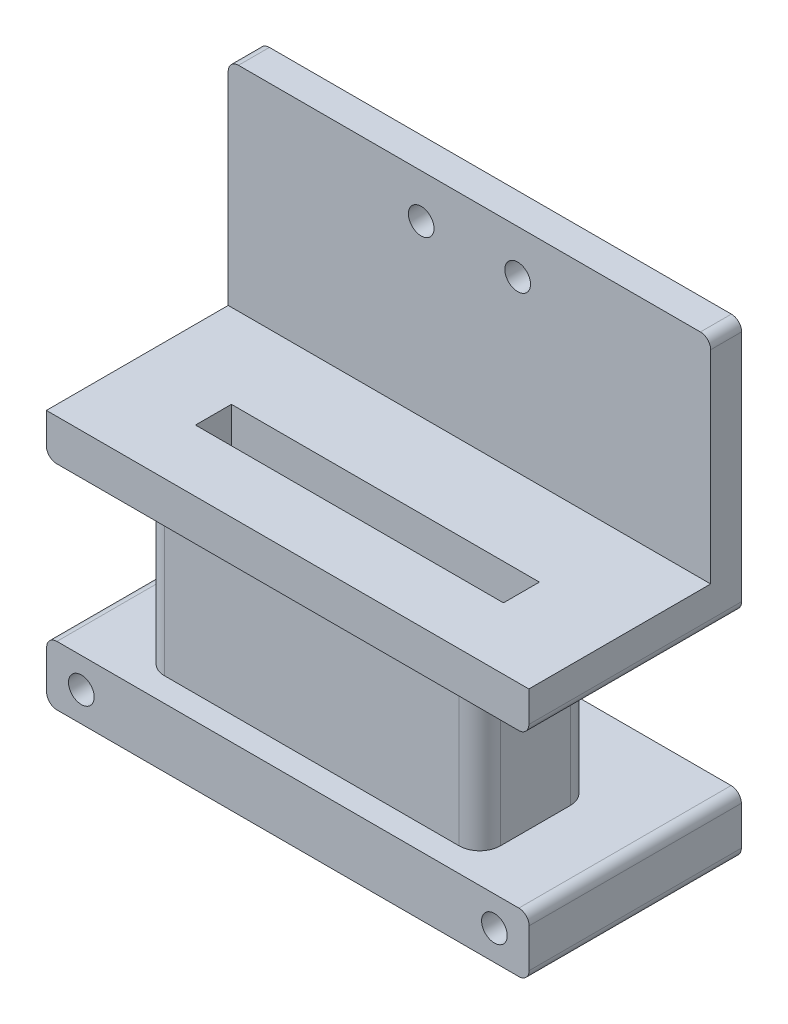
from build123d import *

# Parameters (mm, degrees)
SKETCH1_W             = 32.708231768
SKETCH1_H             = 10.82386404
SKETCH1_W_2           = 30
SKETCH1_H_2           = 3.5
BOSS_EXTRUDE2_DEPTH   = 15
SKETCH4_W             = 47
SKETCH4_H             = 15.552838856
SKETCH4_W_2           = 30
SKETCH4_H_2           = 3.5
BOSS_EXTRUDE4_DEPTH   = 4
SKETCH7_W             = 47
SKETCH7_H             = 15.5
SKETCH7_W_2           = 30
SKETCH7_H_2           = 3.5
BOSS_EXTRUDE5_DEPTH   = 5.782
SKETCH25_W            = 47
SKETCH25_H            = 5.782
BOSS_EXTRUDE9_DEPTH   = 5.175
M3X0_5_TAPPED_HOLE1_D = 2.5
FILLET5_R             = 2
SKETCH26_W            = 47
SKETCH26_H            = 4
BOSS_EXTRUDE10_DEPTH  = 5.175
SKETCH17_W            = 47
SKETCH17_H            = 3.015322823
BOSS_EXTRUDE7_DEPTH   = 20.76
M3X0_5_TAPPED_HOLE2_D = 2.5
FILLET6_R             = 1
FILLET8_R             = 1
FILLET9_R             = 1
FILLET10_R            = 1


with BuildPart() as part:
    # Sketch1 → Boss-Extrude2 (new body)
    with BuildSketch(Plane(origin=(0, 0, 0), x_dir=(1, 0, 0), z_dir=(0, 1, 0))):
        Rectangle(SKETCH1_W, SKETCH1_H)
        Rectangle(SKETCH1_W_2, SKETCH1_H_2, mode=Mode.SUBTRACT)
    extrude(amount=BOSS_EXTRUDE2_DEPTH)

    # Sketch4 → Boss-Extrude4 (add)
    with BuildSketch(Plane(origin=(0, 15, 0), x_dir=(1, 0, 0), z_dir=(0, 1, 0))):
        Rectangle(SKETCH4_W, SKETCH4_H)
        Rectangle(SKETCH4_W_2, SKETCH4_H_2, mode=Mode.SUBTRACT)
    extrude(amount=BOSS_EXTRUDE4_DEPTH)

    # Sketch7 → Boss-Extrude5 (add)
    with BuildSketch(Plane.XZ):
        Rectangle(SKETCH7_W, SKETCH7_H)
        Rectangle(SKETCH7_W_2, SKETCH7_H_2, mode=Mode.SUBTRACT)
    extrude(amount=BOSS_EXTRUDE5_DEPTH)

    # Sketch25 → Boss-Extrude9 (add)
    with BuildSketch(Plane(origin=(0, 0, -7.75), x_dir=(-1, 0, 0), z_dir=(0, 0, -1))):
        with Locations((0, -2.891)):
            Rectangle(SKETCH25_W, SKETCH25_H)
    extrude(amount=BOSS_EXTRUDE9_DEPTH)

    # M3x0.5 Tapped Hole1 (through all)
    with Locations(Plane(origin=(0, 0, 7.75), x_dir=(-1, 0, 0), z_dir=(0, 0, 1))):
        with Locations((20.12, 2.891216796), (-20.12, 2.891216796)):
            Hole(M3X0_5_TAPPED_HOLE1_D / 2)

    # Fillet5
    fillet5_edges = [part.edges().sort_by_distance(p)[0] for p in [
        (16.354115884, 7.5, 5.41193202),
        (-16.354115884, 7.5, 5.41193202),
        (-16.354115884, 7.5, -5.41193202),
        (16.354115884, 7.5, -5.41193202),
    ]]
    fillet(fillet5_edges, radius=FILLET5_R)

    # Sketch26 → Boss-Extrude10 (add)
    with BuildSketch(Plane(origin=(0, 0, -7.776419428), x_dir=(-1, 0, 0), z_dir=(0, 0, -1))):
        with Locations((0, 17)):
            Rectangle(SKETCH26_W, SKETCH26_H)
    extrude(amount=BOSS_EXTRUDE10_DEPTH)

    # Sketch17 → Boss-Extrude7 (add)
    with BuildSketch(Plane(origin=(0, 19, 0), x_dir=(1, 0, 0), z_dir=(0, 1, 0))):
        with Locations((0, 11.443758017)):
            Rectangle(SKETCH17_W, SKETCH17_H)
    extrude(amount=BOSS_EXTRUDE7_DEPTH)

    # M3x0.5 Tapped Hole2 (through all)
    with Locations(Plane(origin=(0, 0, -12.951419428), x_dir=(-1, 0, 0), z_dir=(0, 0, -1))):
        with Locations((-4.7, 35.51), (4.7, 35.51)):
            Hole(M3X0_5_TAPPED_HOLE2_D / 2)

    # Fillet6
    fillet6_edges = [part.edges().sort_by_distance(p)[0] for p in [
        (-23.5, 39.76, -11.443758016),
    ]]
    fillet(fillet6_edges, radius=FILLET6_R)

    # Fillet8
    fillet8_edges = [part.edges().sort_by_distance(p)[0] for p in [
        (23.5, 39.76, -11.443758016),
        (23.5, -5.782, -2.5875),
        (-23.5, -5.782, -2.5875),
        (23.5, 0, -2.5875),
        (-23.5, 0, -2.5875),
    ]]
    fillet(fillet8_edges, radius=FILLET8_R)

    # Fillet9
    fillet9_edges = [part.edges().sort_by_distance(p)[0] for p in [
        (-23.5, 15, -2.5875),
    ]]
    fillet(fillet9_edges, radius=FILLET9_R)

    # Fillet10
    fillet10_edges = [part.edges().sort_by_distance(p)[0] for p in [
        (23.5, 15, -2.5875),
    ]]
    fillet(fillet10_edges, radius=FILLET10_R)


solid = part.part
